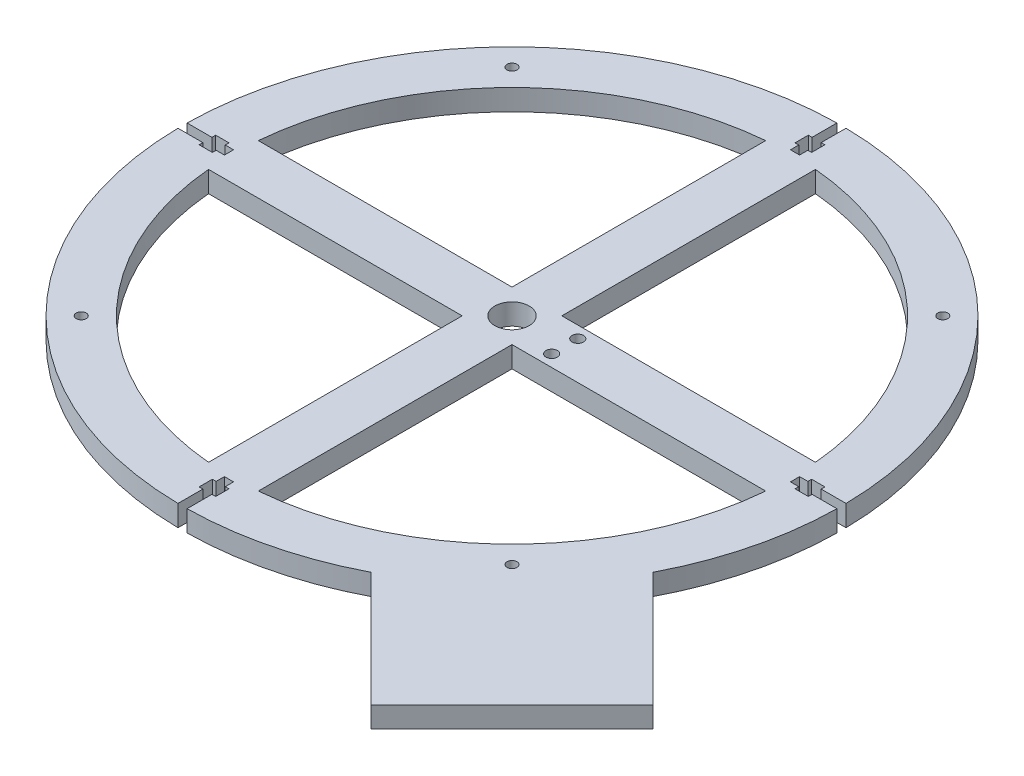
from build123d import *

# Parameters (mm, degrees)
BOSS_EXTRUDE1_DEPTH         = 3.175
SKETCH2_W                   = 2.75
SKETCH2_H                   = 2.5
SKETCH2_H_2                 = 4
SKETCH2_W_2                 = 1.125
SKETCH2_H_3                 = 7.5
CUT_EXTRUDE1_DEPTH          = 174.529048361
CIRPATTERN1_COUNT           = 4
F_3_0_3_DIAMETER_HOLE1_D    = 3
F_3_8_CLEARANCE_HOLE1_D     = 10.31748
F_3_8_CLEARANCE_HOLE1_DEPTH = 6.35
F_4_CLEARANCE_HOLE1_D       = 3.4544


with BuildPart() as part:
    # Sketch1 → Boss-Extrude1 (new, symmetric)
    with BuildSketch(Plane(origin=(0, 0, 0), x_dir=(1, 0, 0), z_dir=(0, 1, 0))):
        with BuildLine():
            ThreePointArc((88.101844639, -45.675437768), (-70.171862751, 70.171862751), (45.675437768, -88.101844639))
            Line((45.675437768, -88.101844639), (80.256619665, -122.683026536))
            Line((80.256619665, -122.683026536), (122.683026536, -80.256619665))
            Line((122.683026536, -80.256619665), (88.101844639, -45.675437768))
        make_face()
        with BuildLine():
            Line((-83.903460262, -7.5), (-7.5, -7.5))
            Line((-7.5, -7.5), (-7.5, -83.903460262))
            ThreePointArc((-7.5, -83.903460262), (-59.565261034, -59.565261034), (-83.903460262, -7.5))
        make_face(mode=Mode.SUBTRACT)
        with BuildLine():
            ThreePointArc((83.903460262, -7.5), (59.565261034, -59.565261034), (7.5, -83.903460262))
            Line((7.5, -83.903460262), (7.5, -7.5))
            Line((7.5, -7.5), (83.903460262, -7.5))
        make_face(mode=Mode.SUBTRACT)
        with BuildLine():
            ThreePointArc((-83.903460262, 7.5), (-59.565261034, 59.565261034), (-7.5, 83.903460262))
            Line((-7.5, 83.903460262), (-7.5, 7.5))
            Line((-7.5, 7.5), (-83.903460262, 7.5))
        make_face(mode=Mode.SUBTRACT)
        with BuildLine():
            ThreePointArc((7.5, 83.903460262), (59.565261034, 59.565261034), (83.903460262, 7.5))
            Line((83.903460262, 7.5), (7.5, 7.5))
            Line((7.5, 7.5), (7.5, 83.903460262))
        make_face(mode=Mode.SUBTRACT)
    extrude(amount=BOSS_EXTRUDE1_DEPTH, both=True)

    # Sketch2 → Cut-Extrude1 (cut, symmetric)
    with BuildSketch(Plane(origin=(0, 0, 0), x_dir=(1, 0, 0), z_dir=(0, 1, 0))):
        with Locations((0, 86.488)):
            Rectangle(SKETCH2_W, SKETCH2_H)
        with Locations((0, 89.738)):
            Rectangle(SKETCH2_W, SKETCH2_H_2)
        with Locations((1.9375, 89.738)):
            Rectangle(SKETCH2_W_2, SKETCH2_H_2)
        with Locations((0, 95.488)):
            Rectangle(SKETCH2_W, SKETCH2_H_3)
        with Locations((-1.9375, 89.738)):
            Rectangle(SKETCH2_W_2, SKETCH2_H_2)
    cut_extrude1 = extrude(amount=CUT_EXTRUDE1_DEPTH, both=True, mode=Mode.SUBTRACT)

    # CirPattern1: Cut-Extrude1 ×4 about axis
    cirpattern1_axis = Axis((0, 0, 0), (0, 1, 0))
    for i in range(1, CIRPATTERN1_COUNT):
        add(cut_extrude1.rotate(cirpattern1_axis, i * 360 / CIRPATTERN1_COUNT), mode=Mode.SUBTRACT)

    # Ø3.0 (3) Diameter Hole1 (through all)
    with Locations(Plane(origin=(0, 3.175, 0), x_dir=(1, 0, 0), z_dir=(0, 1, 0))):
        with Locations((-64.868561892, -64.868561892), (0, 0), (-64.868561892, 64.868561892), (64.868561892, 64.868561892), (64.868561892, -64.868561892)):
            Hole(F_3_0_3_DIAMETER_HOLE1_D / 2)

    # 3/8 Clearance Hole1
    with Locations(Plane(origin=(0, 3.175, 0), x_dir=(1, 0, 0), z_dir=(0, 1, 0))):
        with Locations((0, 0)):
            Hole(F_3_8_CLEARANCE_HOLE1_D / 2, depth=F_3_8_CLEARANCE_HOLE1_DEPTH)

    # #4 Clearance Hole1 (through all)
    with Locations(Plane(origin=(0, 3.175, 0), x_dir=(1, 0, 0), z_dir=(0, 1, 0))):
        with Locations((15.88, -3.94), (15.88, 3.94)):
            Hole(F_4_CLEARANCE_HOLE1_D / 2)


solid = part.part
